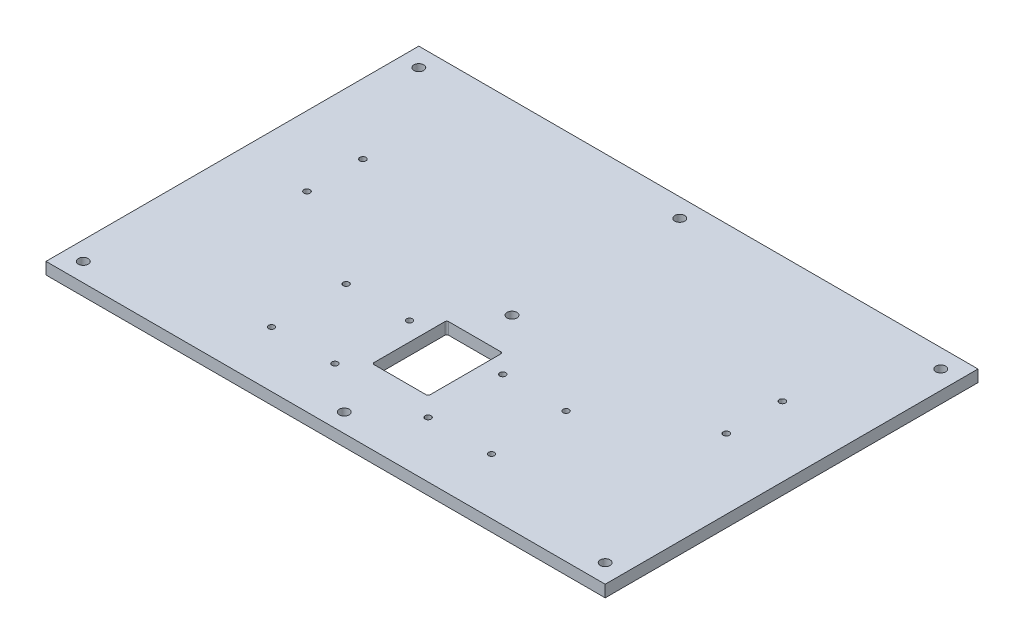
from build123d import *

# Parameters (mm, degrees)
SKETCH1_W                   = 300
SKETCH1_H                   = 200
SKETCH1_W_2                 = 30
SKETCH1_H_2                 = 40
BOSS_EXTRUDE1_DEPTH         = 6.35
TAP_DRILL_FOR_M4X0_7_TAP1_D = 3.3
M3_CLEARANCE_HOLE1_D        = 3.2
M5_CLEARANCE_HOLE1_D        = 5.3
FILLET1_R                   = 1


with BuildPart() as part:
    # Sketch1 → Boss-Extrude1 (new body)
    with BuildSketch(Plane(origin=(0, 0, 0), x_dir=(1, 0, 0), z_dir=(0, 1, 0))):
        Rectangle(SKETCH1_W, SKETCH1_H)
        with Locations((0, -40)):
            Rectangle(SKETCH1_W_2, SKETCH1_H_2, mode=Mode.SUBTRACT)
    extrude(amount=-BOSS_EXTRUDE1_DEPTH)

    # Tap Drill for M4x0.7 Tap1 (through all)
    with Locations(Plane(origin=(-112.5, 0, -32.5), x_dir=(0, 0, 1), z_dir=(0, 1, 0))):
        with Locations((0, 0), (30, 0), (0, 225), (30, 225)):
            Hole(TAP_DRILL_FOR_M4X0_7_TAP1_D / 2)

    # M3 Clearance Hole1 (through all)
    with Locations(Plane(origin=(-59, 0, 30), x_dir=(0, 0, 1), z_dir=(0, 1, 0))):
        with Locations((0, 0), (0, 34), (40, 0), (40, 34), (0, 84), (0, 118), (40, 84), (40, 118)):
            Hole(M3_CLEARANCE_HOLE1_D / 2)

    # M5 Clearance Hole1 (through all)
    with Locations(Plane(origin=(-140, 0, -90), x_dir=(0, 0, 1), z_dir=(0, 1, 0))):
        with Locations((0, 0), (0, 140), (0, 280), (180, 280), (180, 140), (180, 0), (90, 140)):
            Hole(M5_CLEARANCE_HOLE1_D / 2)

    # Fillet1
    fillet1_edges = [part.edges().sort_by_distance(p)[0] for p in [
        (15, -3.175, 20),
        (15, -3.175, 60),
        (-15, -3.175, 60),
        (-15, -3.175, 20),
    ]]
    fillet(fillet1_edges, radius=FILLET1_R)


solid = part.part
